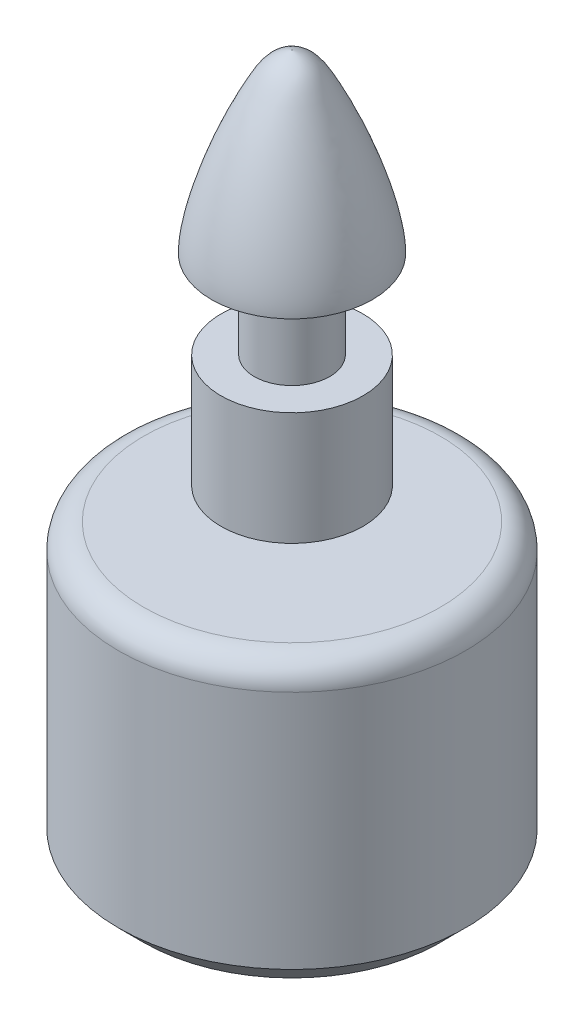
from build123d import *

# Parameters (mm, degrees)
SKETCH_1_R      = 13.8
SKETCH_1_R_2    = 1.25
EXTRUDE_1_DEPTH = 4.6
SKETCH_2_R      = 13.8
EXTRUDE_2_DEPTH = 18.5
FILLET_1_R      = 2
CHAMFER_1_SIZE  = 2


with BuildPart() as part:
    # 草圖1 → 填料-伸長1 (new body)
    with BuildSketch(Plane(origin=(0, 0, 0), x_dir=(1, 0, 0), z_dir=(0, 1, 0))):
        with Locations(Location((0, 0, 0), (0, 0, 270))):
            Circle(SKETCH_1_R)
        with Locations(Location((0, 9.5, 0), (0, 0, 270))):
            Circle(SKETCH_1_R_2, mode=Mode.SUBTRACT)
        with Locations(Location((0, -9.5, 0), (0, 0, 270))):
            Circle(SKETCH_1_R_2, mode=Mode.SUBTRACT)
        with Locations(Location((8, 0, 0), (0, 0, 270))):
            Circle(SKETCH_1_R_2, mode=Mode.SUBTRACT)
        with Locations(Location((-8, 0, 0), (0, 0, 270))):
            Circle(SKETCH_1_R_2, mode=Mode.SUBTRACT)
    extrude(amount=EXTRUDE_1_DEPTH)

    # 草圖2 → 填料-伸長2 (add)
    with BuildSketch(Plane(origin=(0, 4.6, 0), x_dir=(1, 0, 0), z_dir=(0, 1, 0))):
        with Locations(Location((0, 0, 0), (0, 0, 270))):
            Circle(SKETCH_2_R)
    extrude(amount=EXTRUDE_2_DEPTH)

    # 圓角1
    fillet_1_edges = [part.edges().sort_by_distance(p)[0] for p in [
        (0, 23.1, -13.8),
    ]]
    fillet(fillet_1_edges, radius=FILLET_1_R)

    # 草圖5 → 旋轉1 (revolve)
    with BuildSketch(Plane.XY, mode=Mode.PRIVATE) as revolve_1_sk:
        with BuildLine():
            Line((0, 23.1), (0, 55.6))
            add(Edge.make_bspline(
                [(0, 55.6), (-0.448143347, 55.484061035), (-1.523316828, 55.079878449), (-4.652306248, 49.57128747), (-6.4, 43.797195066), (-6.4, 41.6)],
                knots=[0, 0, 0, 0, 0.157070914, 0.257070914, 1, 1, 1, 1], degree=3))
            Line((-6.4, 41.6), (-3, 41.6))
            Line((-3, 41.6), (-3, 34.6))
            Line((-3, 34.6), (-5.65, 34.6))
            Line((-5.65, 34.6), (-5.65, 25.6))
            Line((-5.65, 25.6), (-1.5, 25.6))
            Line((-1.5, 25.6), (-1.5, 23.1))
            Line((-1.5, 23.1), (0, 23.1))
        make_face()
    revolve(revolve_1_sk.sketch.rotate(Axis((0, 23.1, 0), (0, 1, 0)), 180), axis=Axis((0, 23.1, 0), (0, 1, 0)))

    # 導角1
    chamfer_1_edges = [part.edges().sort_by_distance(p)[0] for p in [
        (0, 0, -13.8),
    ]]
    chamfer(chamfer_1_edges, length=CHAMFER_1_SIZE)


solid = part.part
